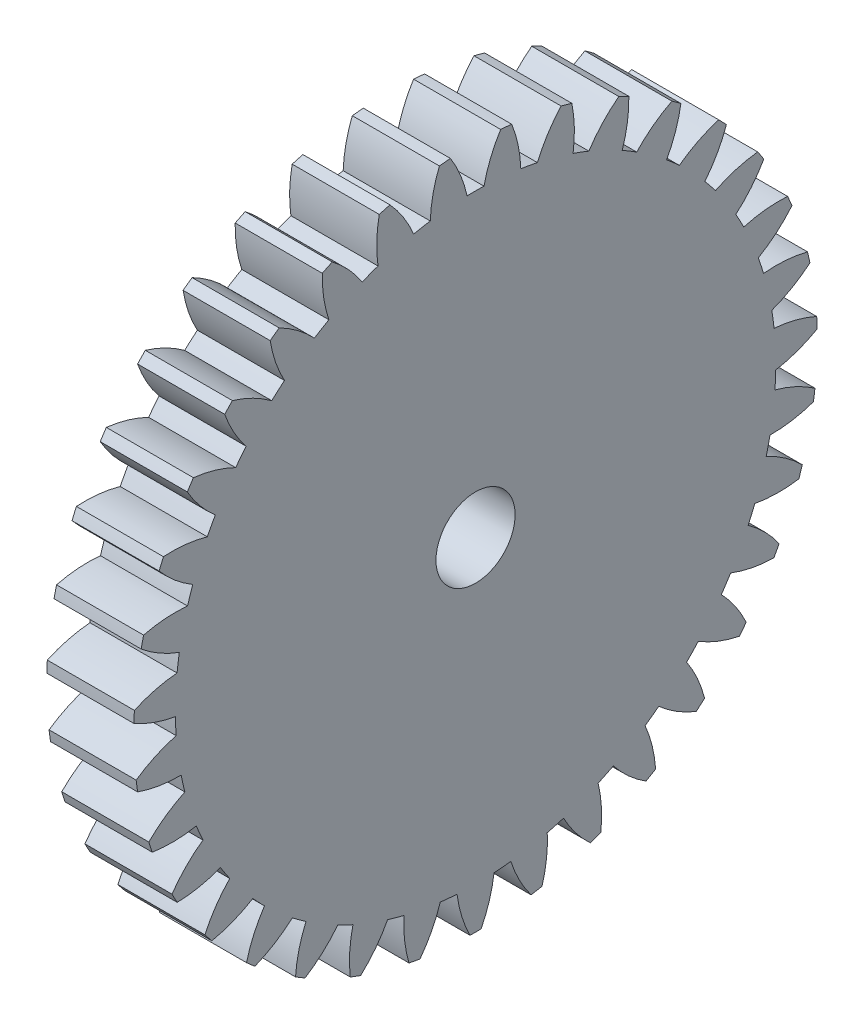
from build123d import *

# Parameters (mm, degrees)
BASPROSKE_W     = 3.3
BASPROSKE_H     = 12.95
TOOTHCUT_DEPTH  = 19.609003197
TEETHCUTS_COUNT = 35
TEETHCUTS_ANGLE = 349.714285714
BORSKE_R        = 1.5
BORE_DEPTH      = 50.0000508


with BuildPart() as part:
    # BasProSke → Base-Revolve (revolve)
    with BuildSketch(Plane(origin=(0, 0, 0), x_dir=(1, 0, 0), z_dir=(0, 1, 0)), mode=Mode.PRIVATE) as base_revolve_sk:
        with Locations((1.65, 6.475)):
            Rectangle(BASPROSKE_W, BASPROSKE_H)
    revolve(base_revolve_sk.sketch.rotate(Axis((-10, 0, 0), (1, 0, 0)), 180), axis=Axis((-10, 0, 0), (1, 0, 0)))

    # TooCutSke → ToothCut (cut, through all)
    with BuildSketch(Plane(origin=(0, 0, 0), x_dir=(0, 0, -1), z_dir=(1, 0, 0))):
        with BuildLine():
            ThreePointArc((0.320037427, 11.369496561), (0, 11.374), (-0.320037427, 11.369496561))
            ThreePointArc((-0.320037427, 11.369496561), (-0.57472711, 12.182636121), (-0.966432546, 12.939359076))
            ThreePointArc((-0.966432546, 12.939359076), (0, 12.9754), (0.966432546, 12.939359076))
            ThreePointArc((0.966432546, 12.939359076), (0.57472711, 12.182636121), (0.320037427, 11.369496561))
        make_face()
    toothcut = extrude(amount=TOOTHCUT_DEPTH, mode=Mode.SUBTRACT)

    # TeethCuts: ToothCut ×35 about axis
    teethcuts_axis = Axis((-10, 0, 0), (1, 0, 0))
    for i in range(1, TEETHCUTS_COUNT):
        add(toothcut.rotate(teethcuts_axis, i * TEETHCUTS_ANGLE / (TEETHCUTS_COUNT - 1)), mode=Mode.SUBTRACT)

    # BorSke → Bore (cut, symmetric)
    with BuildSketch(Plane(origin=(0, 0, 0), x_dir=(0, 0, -1), z_dir=(1, 0, 0))):
        with Locations(Location((0, 0, 0), (0, 0, 180))):
            Circle(BORSKE_R)
    extrude(amount=BORE_DEPTH, both=True, mode=Mode.SUBTRACT)


solid = part.part
